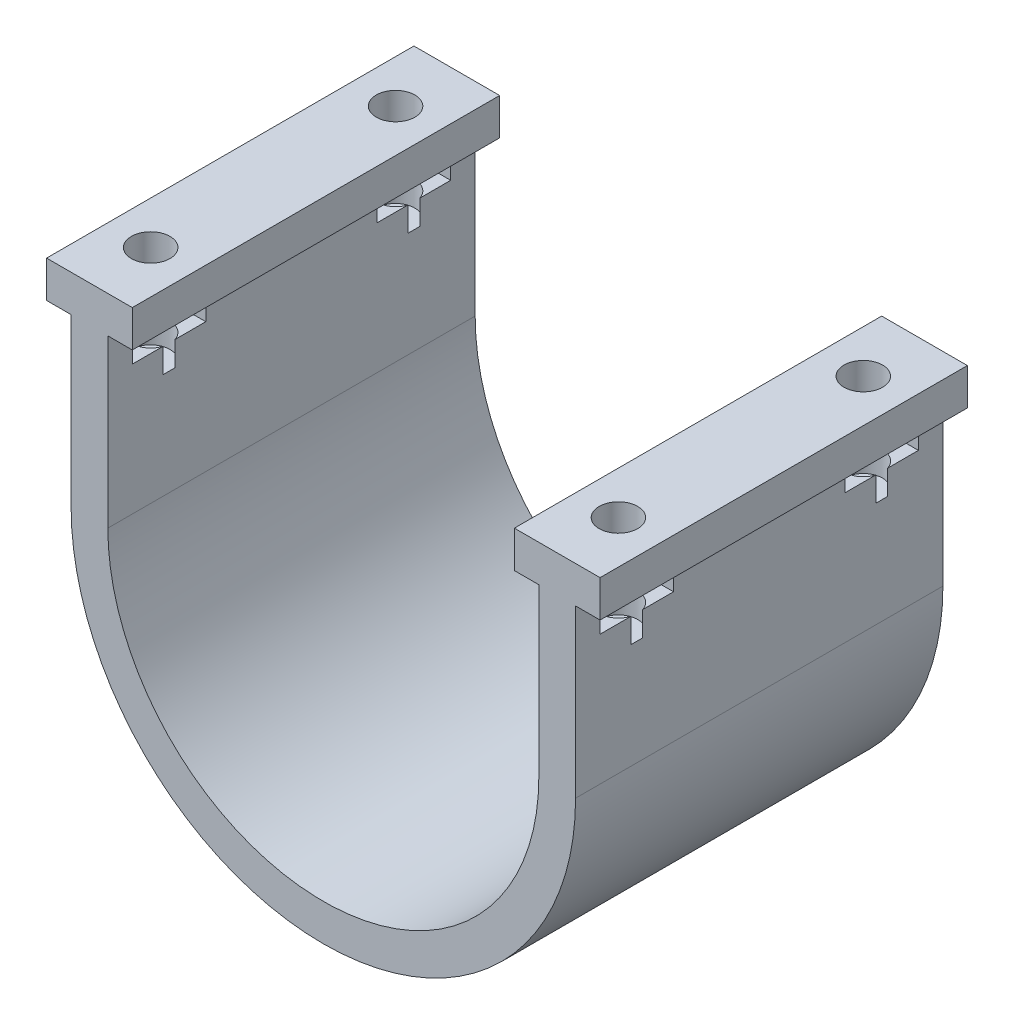
from build123d import *

# Parameters (mm, degrees)
BOSS_EXTRUDE1_DEPTH = 19.05
SKETCH2_R           = 2
CUT_EXTRUDE1_DEPTH  = 10.16
SKETCH3_W           = 7.62
SKETCH3_H           = 3.81
CUT_EXTRUDE2_DEPTH  = 64.697811893


with BuildPart() as part:
    # Sketch1 → Boss-Extrude1 (new, symmetric)
    with BuildSketch(Plane.XY):
        with BuildLine():
            Line((-22.352, 0), (-22.352, 17.272))
            Line((-22.352, 17.272), (-19.812, 17.272))
            Line((-19.812, 17.272), (-19.812, 21.082))
            Line((-19.812, 21.082), (-28.702, 21.082))
            Line((-28.702, 21.082), (-28.702, 17.272))
            Line((-28.702, 17.272), (-26.162, 17.272))
            Line((-26.162, 17.272), (-26.162, 0))
            ThreePointArc((-26.162, 0), (0, -26.162), (26.162, 0))
            Line((26.162, 0), (26.162, 17.272))
            Line((26.162, 17.272), (28.702, 17.272))
            Line((28.702, 17.272), (28.702, 21.082))
            Line((28.702, 21.082), (19.812, 21.082))
            Line((19.812, 21.082), (19.812, 17.272))
            Line((19.812, 17.272), (22.352, 17.272))
            Line((22.352, 17.272), (22.352, 0))
            ThreePointArc((22.352, 0), (0, -22.352), (-22.352, 0))
        make_face()
    extrude(amount=BOSS_EXTRUDE1_DEPTH, both=True)

    # Sketch2 → Cut-Extrude1 (cut)
    with BuildSketch(Plane(origin=(0, 21.082, 0), x_dir=(1, 0, 0), z_dir=(0, 1, 0))):
        with Locations(Location((-24.257, 12.7, 0), (0, 0, 270))):
            Circle(SKETCH2_R)
        with Locations(Location((-24.257, -12.7, 0), (0, 0, 270))):
            Circle(SKETCH2_R)
        with Locations(Location((24.257, -12.7, 0), (0, 0, 270))):
            Circle(SKETCH2_R)
        with Locations(Location((24.257, 12.7, 0), (0, 0, 270))):
            Circle(SKETCH2_R)
    extrude(amount=-CUT_EXTRUDE1_DEPTH, mode=Mode.SUBTRACT)

    # Sketch3 → Cut-Extrude2 (cut, through all)
    with BuildSketch(Plane.ZY.offset(26.162)):
        with Locations((-12.7, 15.367)):
            Rectangle(SKETCH3_W, SKETCH3_H)
        with Locations((12.7, 15.367)):
            Rectangle(SKETCH3_W, SKETCH3_H)
    extrude(amount=-CUT_EXTRUDE2_DEPTH, mode=Mode.SUBTRACT)


solid = part.part
